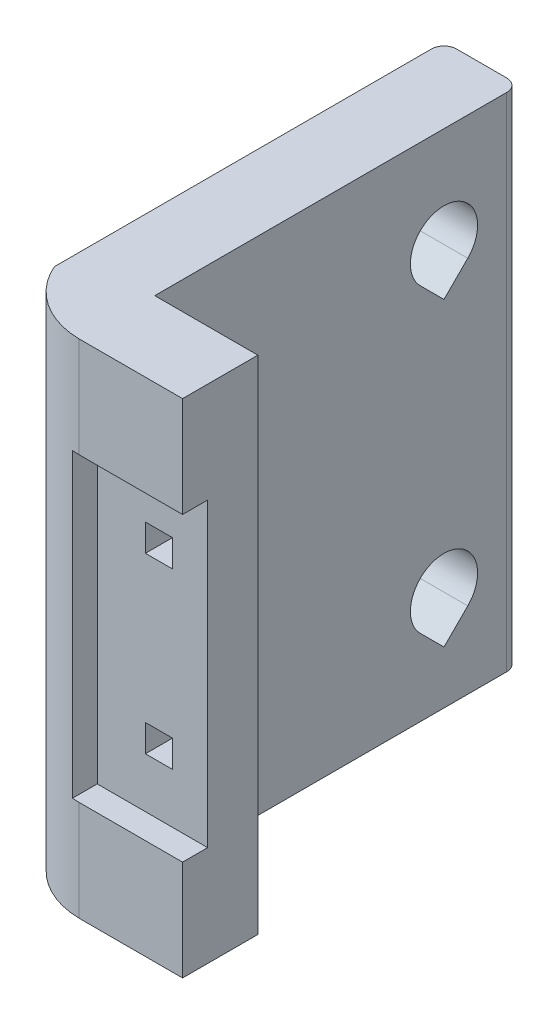
from build123d import *

# Parameters (mm, degrees)
BOSS_EXTRUDE1_DEPTH = 100
CUT_EXTRUDE1_DEPTH  = 126.693414536
SKETCH3_W           = 5.4
SKETCH3_H           = 5.4
CUT_EXTRUDE2_DEPTH  = 139.050096295
SKETCH4_W           = 22
SKETCH4_H           = 60
CUT_EXTRUDE3_DEPTH  = 5
FILLET1_R           = 2.5


with BuildPart() as part:
    # Sketch1 → Boss-Extrude1 (new body)
    with BuildSketch(Plane(origin=(0, 0, 0), x_dir=(-1, 0, 0), z_dir=(0, 1, 0))):
        with BuildLine():
            Line((-16.539379475, 20.305108986), (-16.462740437, 20.305108986))
            ThreePointArc((-16.462740437, 20.305108986), (-7.525387839, 17.507307751), (-1.539379475, 10.305108986))
            Line((-1.539379475, 10.305108986), (-1.539379475, -67.344891014))
            Line((-1.539379475, -67.344891014), (-16.539379475, -67.344891014))
            Line((-16.539379475, -67.344891014), (-16.539379475, 5.305108986))
            Line((-16.539379475, 5.305108986), (-37.085126223, 5.305108986))
            Line((-37.085126223, 5.305108986), (-37.085126223, 20.305108986))
            Line((-37.085126223, 20.305108986), (-16.539379475, 20.305108986))
        make_face()
    extrude(amount=BOSS_EXTRUDE1_DEPTH)

    # Sketch2 → Cut-Extrude1 (cut, through all)
    with BuildSketch(Plane(origin=(1.539379475, 0, 0), x_dir=(0, -1, 0), z_dir=(-1, 0, 0))):
        with BuildLine():
            Line((-75.262384566, -47.60727558), (-70.524769132, -52.344891014))
            Line((-70.524769132, -52.344891014), (-75.262384566, -57.082506448))
            ThreePointArc((-75.262384566, -57.082506448), (-86.7, -52.344891014), (-75.262384566, -47.60727558))
        make_face()
        with BuildLine():
            Line((-10.524769132, -52.344891014), (-15.262384566, -47.60727558))
            ThreePointArc((-15.262384566, -47.60727558), (-26.7, -52.344891014), (-15.262384566, -57.082506448))
            Line((-15.262384566, -57.082506448), (-10.524769132, -52.344891014))
        make_face()
    extrude(amount=-CUT_EXTRUDE1_DEPTH, mode=Mode.SUBTRACT)

    # Sketch3 → Cut-Extrude2 (cut, through all)
    with BuildSketch(Plane.XY.offset(20.305108986)):
        with Locations((27.385126223, 32.7)):
            Rectangle(SKETCH3_W, SKETCH3_H)
        with Locations((27.385126223, 67.3)):
            Rectangle(SKETCH3_W, SKETCH3_H)
    extrude(amount=-CUT_EXTRUDE2_DEPTH, mode=Mode.SUBTRACT)

    # Sketch4 → Cut-Extrude3 (cut)
    with BuildSketch(Plane.XY.offset(20.305108986)):
        with Locations((26.085126223, 50)):
            Rectangle(SKETCH4_W, SKETCH4_H)
    extrude(amount=-CUT_EXTRUDE3_DEPTH, mode=Mode.SUBTRACT)

    # Fillet1
    fillet1_edges = [part.edges().sort_by_distance(p)[0] for p in [
        (1.539379475, 50, -67.344891014),
        (16.539379475, 50, -67.344891014),
    ]]
    fillet(fillet1_edges, radius=FILLET1_R)


solid = part.part
